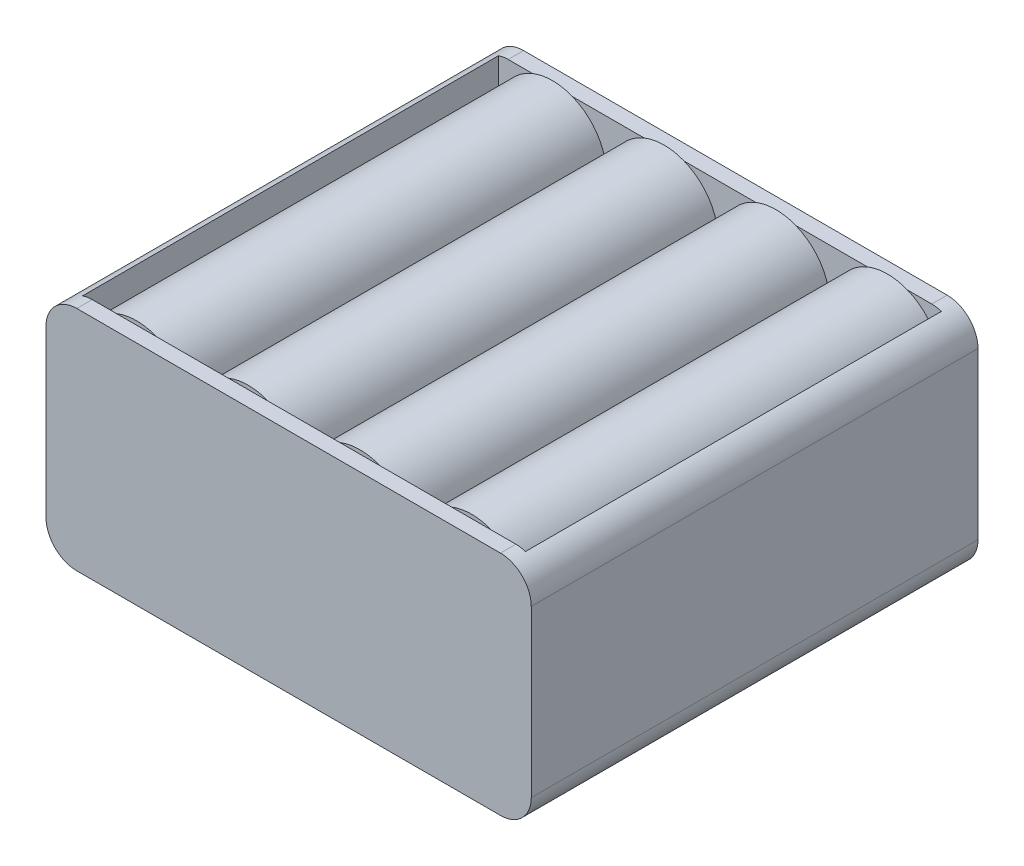
from build123d import *
from build123d.topology import SkipClean

# Parameters (mm, degrees)
SKETCH1_W           = 63
SKETCH1_H           = 58
BOSS_EXTRUDE1_DEPTH = 29.5
FILLET1_R           = 4
CUT_EXTRUDE1_DEPTH  = 27
SKETCH3_R           = 7
BOSS_EXTRUDE2_DEPTH = 27
BOSS_EXTRUDE3_DEPTH = 7


with BuildPart() as part:
    # Sketch1 → Boss-Extrude1 (new body)
    with BuildSketch(Plane(origin=(0, 0, 0), x_dir=(1, 0, 0), z_dir=(0, 1, 0))):
        Rectangle(SKETCH1_W, SKETCH1_H)
    extrude(amount=BOSS_EXTRUDE1_DEPTH)

    # Fillet1
    fillet1_edges = [part.edges().sort_by_distance(p)[0] for p in [
        (-31.5, 29.5, 0),
        (31.5, 29.5, 0),
        (-31.5, 0, 0),
        (31.5, 0, 0),
    ]]
    fillet(fillet1_edges, radius=FILLET1_R)

    # Sketch2 → Cut-Extrude1 (cut, symmetric)
    with BuildSketch(Plane.XY):
        with BuildLine():
            Line((-14.75, 23), (-14.25, 23))
            ThreePointArc((-14.25, 23), (-7.25, 30), (-0.25, 23))
            Line((-0.25, 23), (0.25, 23))
            ThreePointArc((0.25, 23), (7.25, 30), (14.25, 23))
            Line((14.25, 23), (14.75, 23))
            ThreePointArc((14.75, 23), (21.75, 30), (28.75, 23))
            Line((28.75, 23), (28.75, 32.890330219))
            Line((28.75, 32.890330219), (-28.75, 32.890330219))
            Line((-28.75, 32.890330219), (-28.75, 23))
            ThreePointArc((-28.75, 23), (-21.75, 30), (-14.75, 23))
        make_face()
        with BuildLine():
            Line((-14.75, 6.5), (-14.25, 6.5))
            ThreePointArc((-14.25, 6.5), (-7.25, -0.5), (-0.25, 6.5))
            Line((-0.25, 6.5), (0.25, 6.5))
            ThreePointArc((0.25, 6.5), (7.25, -0.5), (14.25, 6.5))
            Line((14.25, 6.5), (14.75, 6.5))
            ThreePointArc((14.75, 6.5), (21.75, -0.5), (28.75, 6.5))
            Line((28.75, 6.5), (28.75, -3.999416428))
            Line((28.75, -3.999416428), (-28.75, -3.472007121))
            Line((-28.75, -3.472007121), (-28.75, 6.5))
            ThreePointArc((-28.75, 6.5), (-21.75, -0.5), (-14.75, 6.5))
        make_face()
    extrude(amount=CUT_EXTRUDE1_DEPTH, both=True, mode=Mode.SUBTRACT)

    # Sketch3 → Boss-Extrude2 (add, symmetric)
    with SkipClean():  # the faces are left unmerged after this step: merging them gives an invalid solid
        with BuildSketch(Plane.XY):
            with Locations((-21.75, 23)):
                Circle(SKETCH3_R)
            with Locations((-7.25, 23)):
                Circle(SKETCH3_R)
            with Locations((7.25, 23)):
                Circle(SKETCH3_R)
            with Locations((21.75, 23)):
                Circle(SKETCH3_R)
            with Locations((21.75, 6.5)):
                Circle(SKETCH3_R)
            with Locations((7.25, 6.5)):
                Circle(SKETCH3_R)
            with Locations((-7.25, 6.5)):
                Circle(SKETCH3_R)
            with Locations((-21.75, 6.5)):
                Circle(SKETCH3_R)
        extrude(amount=BOSS_EXTRUDE2_DEPTH, both=True)

    # Sketch4 → Boss-Extrude3 (add)
    with SkipClean():  # the faces are left unmerged after this step: merging them gives an invalid solid
        with BuildSketch(Plane(origin=(0, 0, -29), x_dir=(-1, 0, 0), z_dir=(0, 0, -1))):
            with BuildLine():
                Line((28.5, 15), (4.5, 15))
                ThreePointArc((4.5, 15), (2.378679656, 14.121320344), (1.5, 12))
                Line((1.5, 12), (1.5, 3))
                ThreePointArc((1.5, 3), (2.378679656, 0.878679656), (4.5, 0))
                Line((4.5, 0), (28.5, 0))
                ThreePointArc((28.5, 0), (30.621320344, 0.878679656), (31.5, 3))
                Line((31.5, 3), (31.5, 12))
                ThreePointArc((31.5, 12), (30.621320344, 14.121320344), (28.5, 15))
            make_face()
        extrude(amount=BOSS_EXTRUDE3_DEPTH)


solid = part.part
